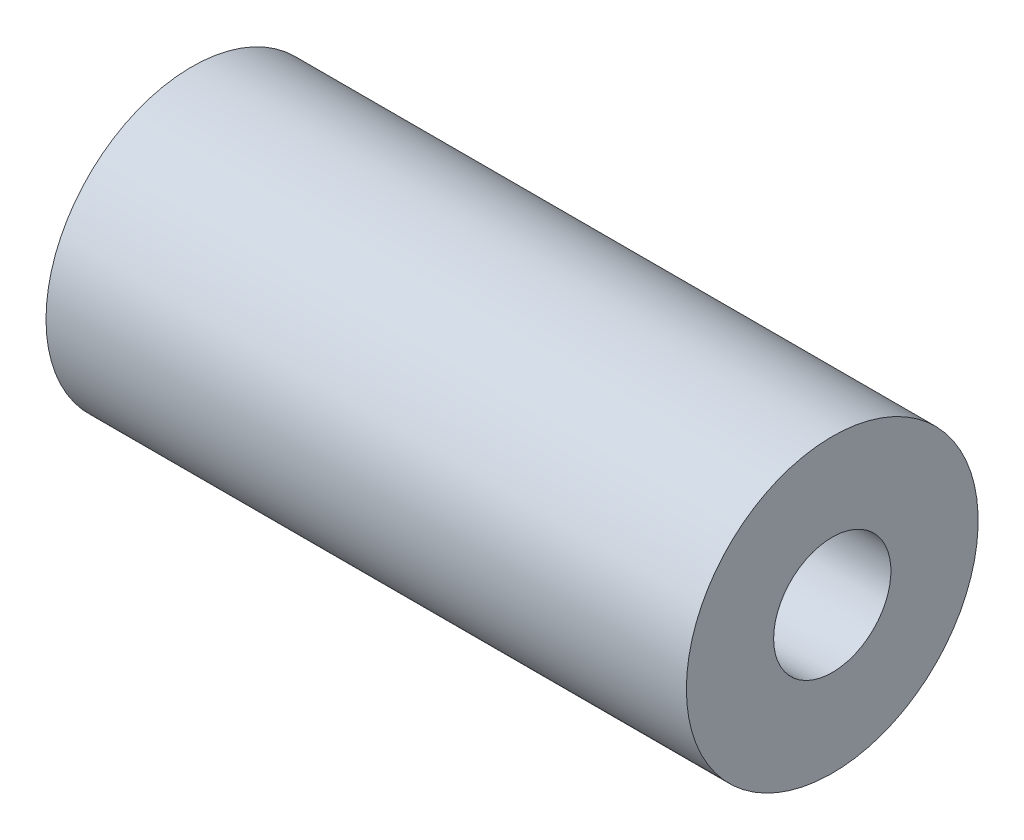
from build123d import *

# Parameters (mm, degrees)
SKETCH1_R           = 6.35
SKETCH1_R_2         = 2.5527
BOSS_EXTRUDE1_DEPTH = 27.875200028


with BuildPart() as part:
    # Sketch1 → Boss-Extrude1 (new body)
    with BuildSketch(Plane(origin=(0, 0, 0), x_dir=(0, 0, -1), z_dir=(1, 0, 0))):
        with Locations(Location((0, 0, 0), (0, 0, 180))):
            Circle(SKETCH1_R)
        with Locations(Location((0, 0, 0), (0, 0, 180))):
            Circle(SKETCH1_R_2, mode=Mode.SUBTRACT)
    extrude(amount=BOSS_EXTRUDE1_DEPTH)


solid = part.part
